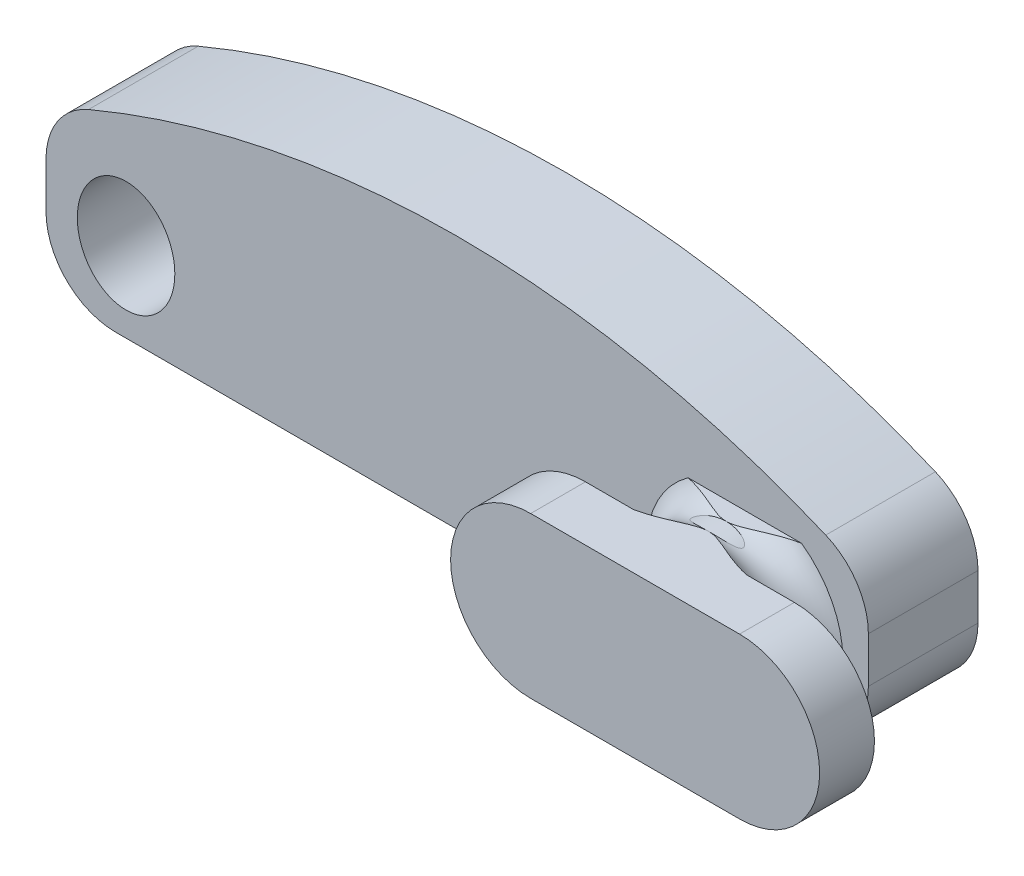
from build123d import *

# Parameters (mm, degrees)
SKETCH1_W           = 30
SKETCH1_H           = 5.842
BOSS_EXTRUDE1_DEPTH = 4
SKETCH2_RX          = 2.921
SKETCH2_RY          = 2.54
BOSS_EXTRUDE2_DEPTH = 2
BOSS_EXTRUDE3_DEPTH = 2
CUT_EXTRUDE1_REACH  = 32.824
SKETCH4_RX          = 2.032
SKETCH4_RY          = 1.778
SKETCH6_W           = 9.717088915
SKETCH6_H           = 3.843326416
SKETCH6_H_2         = 2.783897542
CUT_EXTRUDE2_DEPTH  = 32.721416673
BOSS_EXTRUDE4_DEPTH = 4
FILLET1_R           = 2.54
FILLET2_R           = 2.54


with BuildPart() as part:
    # Sketch1 → Boss-Extrude1 (new body)
    with BuildSketch(Plane.XY):
        with Locations((-15, 2.921)):
            Rectangle(SKETCH1_W, SKETCH1_H)
    extrude(amount=BOSS_EXTRUDE1_DEPTH)

    # Sketch2 → Boss-Extrude2 (add)
    with BuildSketch(Plane.XY.offset(4)):
        with Locations(Location((-4.5085, 2.921), (0, 0, -90))):
            Ellipse(SKETCH2_RX, SKETCH2_RY)
    extrude(amount=BOSS_EXTRUDE2_DEPTH)

    # Sketch3 → Boss-Extrude3 (add)
    with BuildSketch(Plane.XY.offset(6)):
        with BuildLine():
            Line((-0.6985, 0), (-8.3185, 0))
            ThreePointArc((-8.3185, 0), (-11.2395, 2.921), (-8.3185, 5.842))
            Line((-8.3185, 5.842), (-0.6985, 5.842))
            ThreePointArc((-0.6985, 5.842), (2.2225, 2.921), (-0.6985, 0))
        make_face()
    extrude(amount=BOSS_EXTRUDE3_DEPTH)

    # Sketch4 → Cut-Extrude1 (cut, up to next)
    with BuildSketch(Plane.XY.offset(4), mode=Mode.PRIVATE) as cut_extrude1_sk1:
        with Locations(Location((-27.079, 2.921), (0, 0, 90))):
            Ellipse(SKETCH4_RX, SKETCH4_RY)
    cut_extrude1_tool1 = extrude(cut_extrude1_sk1.sketch, amount=-CUT_EXTRUDE1_REACH, mode=Mode.PRIVATE) & part.part
    add(cut_extrude1_tool1.solids().sort_by_distance((-27.079, 2.921, 4))[0], mode=Mode.SUBTRACT)

    # Sketch5 → Revolve2 (revolve)
    with BuildSketch(Plane.XZ.offset(-2.921), mode=Mode.PRIVATE) as revolve2_sk:
        with BuildLine():
            Line((-0.92963332, 6), (-3.346519665, 6))
            Line((-3.346519665, 6), (-3.346519665, 4))
            Line((-3.346519665, 4), (-0.92963332, 4))
            ThreePointArc((-0.92963332, 4), (-1.636935053, 5), (-0.92963332, 6))
        make_face()
    revolve(revolve2_sk.sketch.rotate(Axis((-4.5085, 2.921, 5), (0, 0, 1)), 125.29577831), axis=Axis((-4.5085, 2.921, 5), (0, 0, 1)))

    # Sketch6 → Cut-Extrude2 (cut, through all)
    with BuildSketch(Plane.XY.offset(8)):
        with Locations((-4.858544458, 7.763663208)):
            Rectangle(SKETCH6_W, SKETCH6_H)
        with Locations((-4.858544458, -1.391948771)):
            Rectangle(SKETCH6_W, SKETCH6_H_2)
    extrude(amount=-CUT_EXTRUDE2_DEPTH, mode=Mode.SUBTRACT)

    # Sketch7 → Boss-Extrude4 (add)
    with BuildSketch(Plane.XY):
        with BuildLine():
            Line((-30, 5.842), (0, 5.842))
            ThreePointArc((0, 5.842), (-15, 9.260567291), (-30, 5.842))
        make_face()
    extrude(amount=BOSS_EXTRUDE4_DEPTH)

    # Fillet1
    fillet1_edges = [part.edges().sort_by_distance(p)[0] for p in [
        (0, 0, 2),
        (-30, 0, 2),
    ]]
    fillet(fillet1_edges, radius=FILLET1_R)

    # Fillet2
    fillet2_edges = [part.edges().sort_by_distance(p)[0] for p in [
        (-30, 5.842, 2),
        (0, 5.842, 2),
    ]]
    fillet(fillet2_edges, radius=FILLET2_R)


solid = part.part
